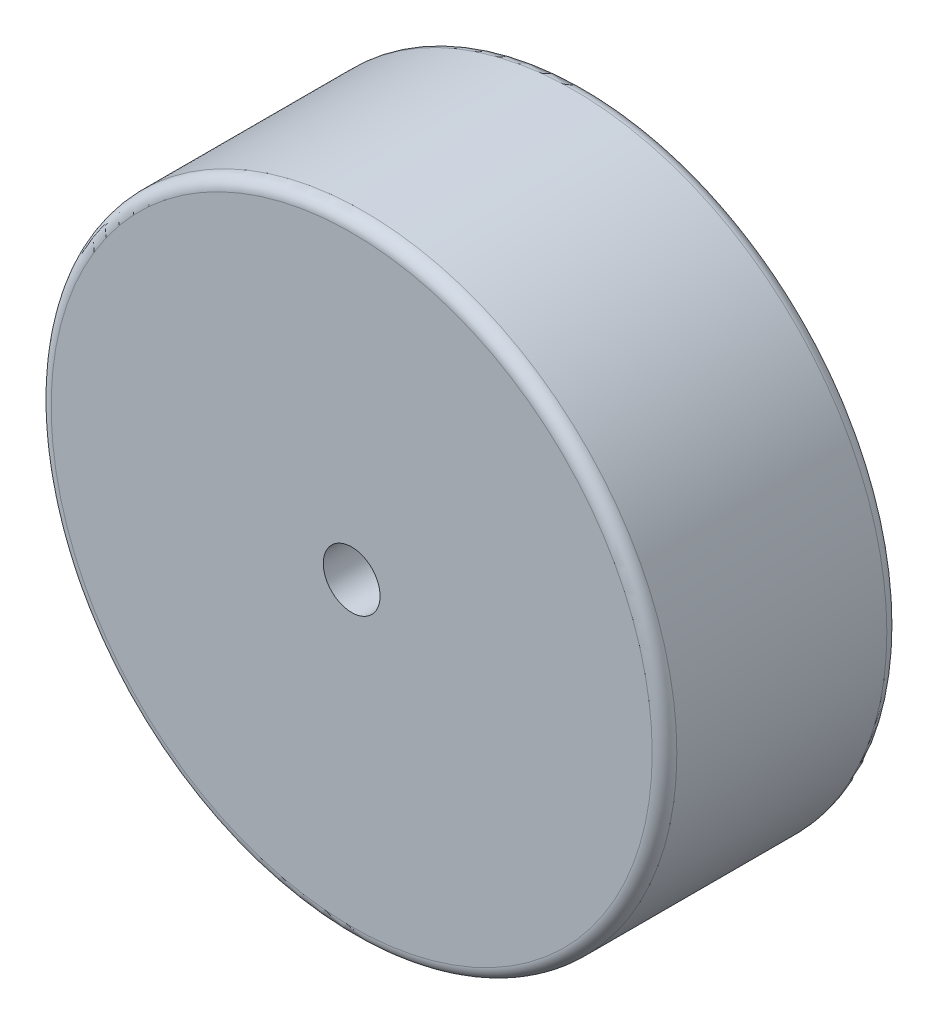
from build123d import *

# Parameters (mm, degrees)
BODY_SKETCH_R    = 25.4
WHEEL_BODY_DEPTH = 9.525
FILLET_WHEEL_R   = 1
HOLE_SKETCH_R    = 2.305
HOLE_SHAFT_DEPTH = 15


with BuildPart() as part:
    # body sketch → wheel body (new, symmetric)
    with BuildSketch(Plane.XY):
        with Locations(Location((0, 0, 0), (0, 0, 180))):
            Circle(BODY_SKETCH_R)
    extrude(amount=WHEEL_BODY_DEPTH, both=True)

    # fillet wheel
    fillet_wheel_edges = [part.edges().sort_by_distance(p)[0] for p in [
        (25.4, 0, -9.525),
        (25.4, 0, 9.525),
    ]]
    fillet(fillet_wheel_edges, radius=FILLET_WHEEL_R)

    # hole sketch → hole shaft (cut)
    with BuildSketch(Plane.XY.offset(9.525)):
        Circle(HOLE_SKETCH_R)
    extrude(amount=-HOLE_SHAFT_DEPTH, mode=Mode.SUBTRACT)


solid = part.part
